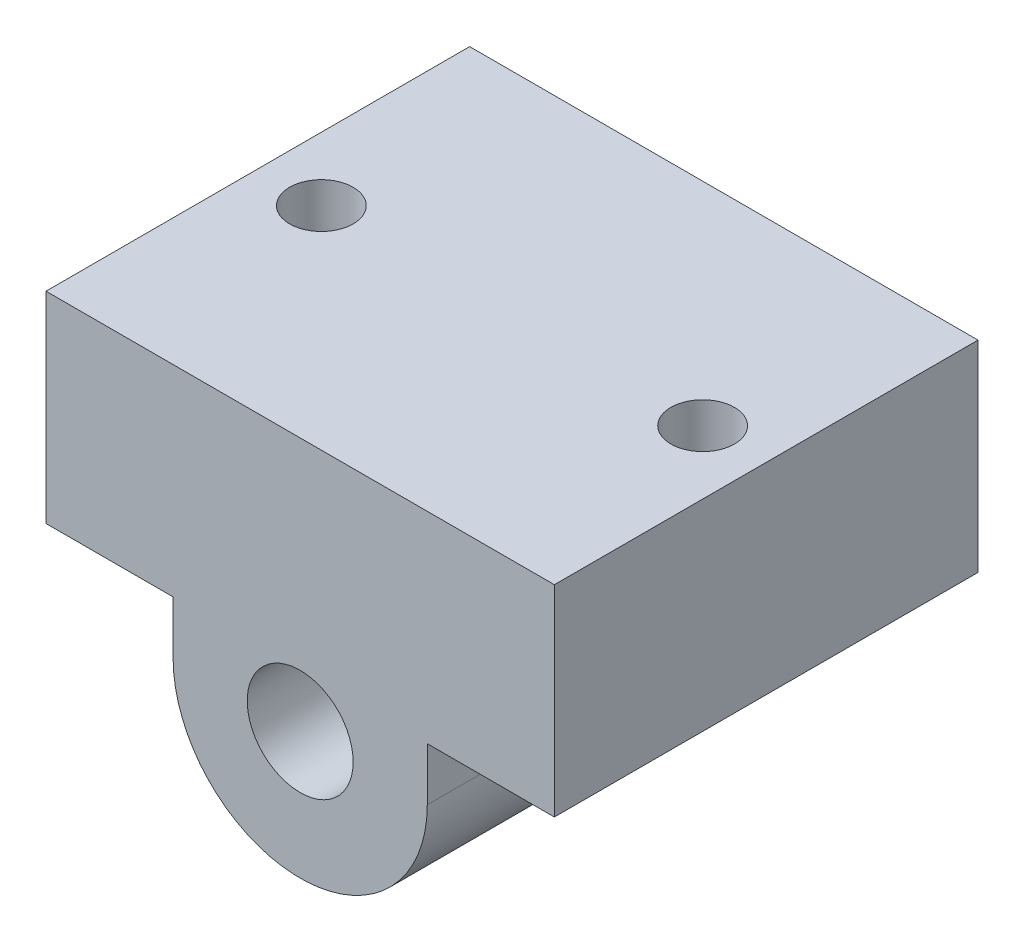
from build123d import *

# Parameters (mm, degrees)
ESQUISSE1_R             = 2.5
BOSS_EXTRU_1_DEPTH      = 20
ESQUISSE2_R             = 1.5
ENL_V_MAT_EXTRU_1_DEPTH = 10


with BuildPart() as part:
    # Esquisse1 → Boss.-Extru.1 (new body)
    with BuildSketch(Plane.XY):
        with BuildLine():
            ThreePointArc((-6, 0), (0, -6), (6, 0))
            Line((6, 0), (6, 2.5))
            Line((6, 2.5), (12, 2.5))
            Line((12, 2.5), (12, 12))
            Line((12, 12), (-12, 12))
            Line((-12, 12), (-12, 2.5))
            Line((-12, 2.5), (-6, 2.5))
            Line((-6, 2.5), (-6, 0))
        make_face()
        Circle(ESQUISSE1_R, mode=Mode.SUBTRACT)
    extrude(amount=-BOSS_EXTRU_1_DEPTH)

    # Esquisse2 → Enlèv. mat.-Extru.1 (cut)
    with BuildSketch(Plane.XZ.offset(-2.5)):
        with Locations(Location((-9, -10, 0), (0, 0, 270))):
            Circle(ESQUISSE2_R)
        with Locations(Location((9, -10, 0), (0, 0, 270))):
            Circle(ESQUISSE2_R)
    extrude(amount=-ENL_V_MAT_EXTRU_1_DEPTH, mode=Mode.SUBTRACT)


solid = part.part
